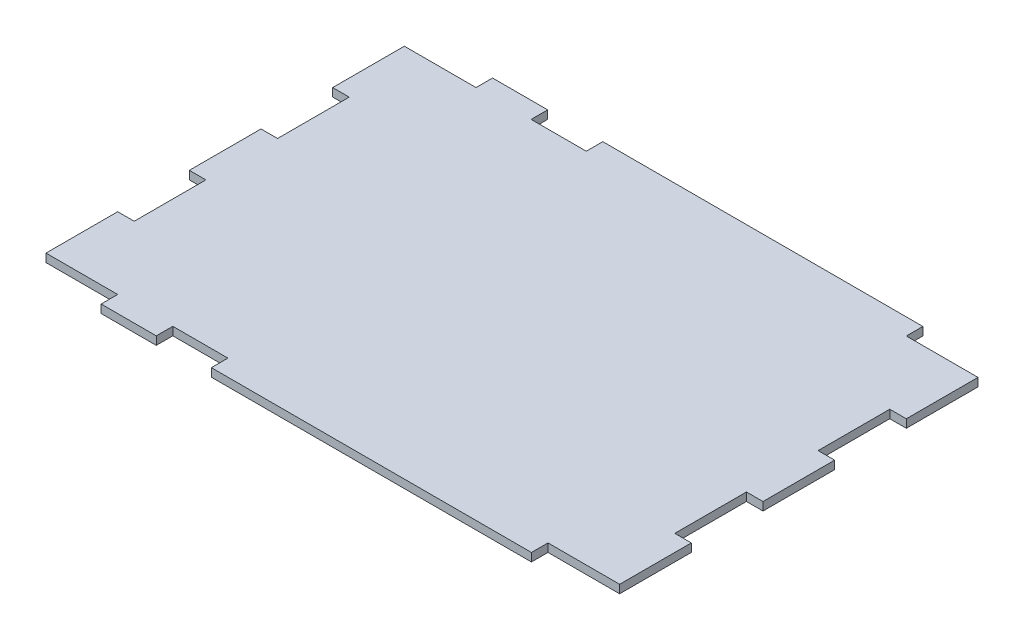
from build123d import *

# Parameters (mm, degrees)
BOSS_EXTRUDE1_DEPTH = 3


with BuildPart() as part:
    # Sketch2 → Boss-Extrude1 (new body)
    with BuildSketch(Plane(origin=(0, 0, 0), x_dir=(1, 0, 0), z_dir=(0, 1, 0))):
        Polygon((-122.911356388, -52), (-128.911356388, -52), (-128.911356388, -26), (-122.911356388, -26), (-122.911356388, 0), (-128.911356388, 0), (-128.911356388, 26), (-122.911356388, 26), (-122.911356388, 52), (-128.911356388, 52), (-128.911356388, 78), (-122.911356388, 78), (-102.911356388, 78), (-102.911356388, 84), (-82.911356388, 84), (-82.911356388, 78), (-62.911356388, 78), (-62.911356388, 84), (53.188643612, 84), (53.188643612, 78), (79.188643612, 78), (79.188643612, 52), (73.188643612, 52), (73.188643612, 26), (79.188643612, 26), (79.188643612, 0), (73.188643612, 0), (73.188643612, -26), (79.188643612, -26), (79.188643612, -52), (73.188643612, -52), (53.188643612, -52), (53.188643612, -58), (-62.911356388, -58), (-62.911356388, -52), (-82.911356388, -52), (-82.911356388, -58), (-102.911356388, -58), (-102.911356388, -52), align=None)
    extrude(amount=BOSS_EXTRUDE1_DEPTH)


solid = part.part
